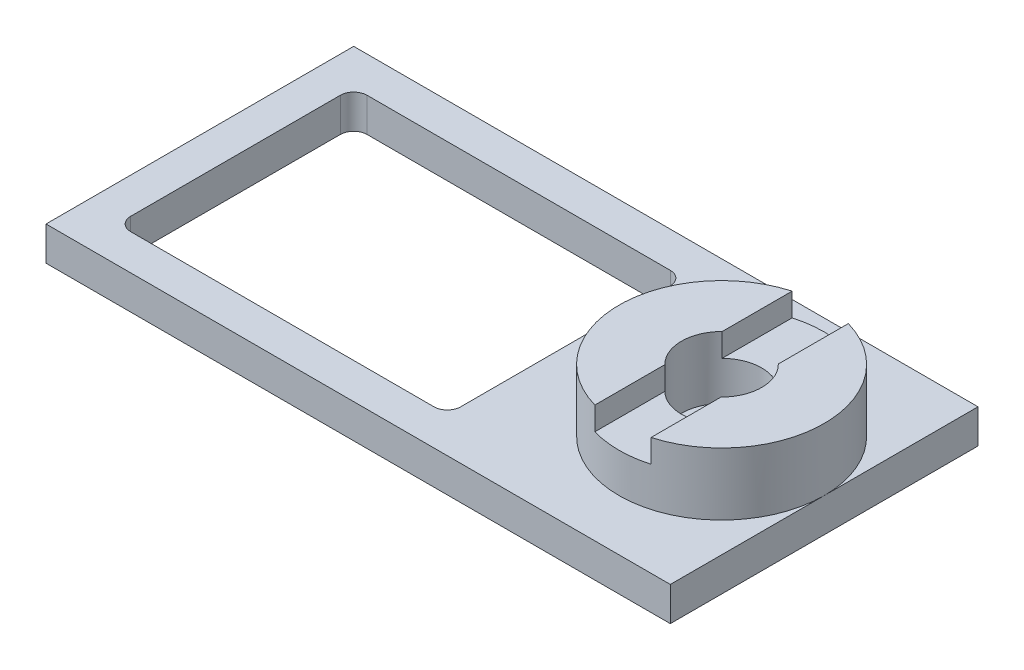
from build123d import *

# Parameters (mm, degrees)
CROQUIS1_W              = 700
CROQUIS1_H              = 345
SALIENTE_EXTRUIR1_DEPTH = 38.1
CROQUIS2_W              = 370
CROQUIS2_H              = 265
CORTAR_EXTRUIR1_DEPTH   = 38.1
REDONDEO1_R             = 15
CROQUIS3_R              = 115
SALIENTE_EXTRUIR2_DEPTH = 70
CROQUIS4_R              = 45
CORTAR_EXTRUIR2_DEPTH   = 70
CROQUIS5_W              = 63
CROQUIS5_H              = 247.074165674
CORTAR_EXTRUIR3_DEPTH   = 26


with BuildPart() as part:
    # Croquis1 → Saliente-Extruir1 (new body)
    with BuildSketch(Plane(origin=(0, 0, 0), x_dir=(1, 0, 0), z_dir=(0, 1, 0))):
        Rectangle(CROQUIS1_W, CROQUIS1_H)
    extrude(amount=SALIENTE_EXTRUIR1_DEPTH)

    # Croquis2 → Cortar-Extruir1 (cut)
    with BuildSketch(Plane(origin=(0, 38.1, 0), x_dir=(1, 0, 0), z_dir=(0, 1, 0))):
        with Locations((-125, 0)):
            Rectangle(CROQUIS2_W, CROQUIS2_H)
    extrude(amount=-CORTAR_EXTRUIR1_DEPTH, mode=Mode.SUBTRACT)

    # Redondeo1
    redondeo1_edges = [part.edges().sort_by_distance(p)[0] for p in [
        (-310, 19.05, 132.5),
        (-310, 19.05, -132.5),
        (60, 19.05, -132.5),
        (60, 19.05, 132.5),
    ]]
    fillet(redondeo1_edges, radius=REDONDEO1_R)

    # Croquis3 → Saliente-Extruir2 (add)
    with BuildSketch(Plane(origin=(0, 38.1, 0), x_dir=(1, 0, 0), z_dir=(0, 1, 0))):
        with Locations((235, 0)):
            Circle(CROQUIS3_R)
    extrude(amount=SALIENTE_EXTRUIR2_DEPTH)

    # Croquis4 → Cortar-Extruir2 (cut)
    with BuildSketch(Plane(origin=(0, 108.1, 0), x_dir=(1, 0, 0), z_dir=(0, 1, 0))):
        with Locations(Location((235, 0, 0), (0, 0, 270))):
            Circle(CROQUIS4_R)
    extrude(amount=-CORTAR_EXTRUIR2_DEPTH, mode=Mode.SUBTRACT)

    # Croquis5 → Cortar-Extruir3 (cut)
    with BuildSketch(Plane(origin=(0, 108.1, 0), x_dir=(1, 0, 0), z_dir=(0, 1, 0))):
        with Locations((235, 0)):
            Rectangle(CROQUIS5_W, CROQUIS5_H)
    extrude(amount=-CORTAR_EXTRUIR3_DEPTH, mode=Mode.SUBTRACT)


solid = part.part
